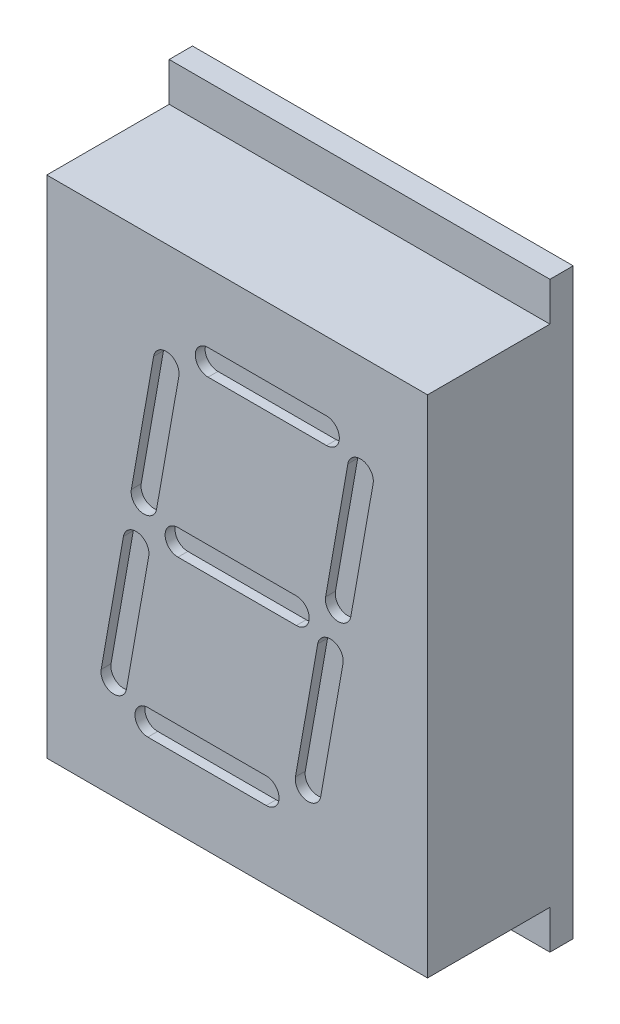
from build123d import *

# Parameters (mm, degrees)
SKETCH2_W           = 9.8
SKETCH2_H           = 15
BOSS_EXTRUDE1_DEPTH = 0.6
SKETCH3_W           = 9.8
SKETCH3_H           = 13
BOSS_EXTRUDE2_DEPTH = 3.15
CUT_EXTRUDE1_DEPTH  = 0.254


with BuildPart() as part:
    # Sketch2 → Boss-Extrude1 (new body)
    with BuildSketch(Plane.XY):
        Rectangle(SKETCH2_W, SKETCH2_H)
    extrude(amount=BOSS_EXTRUDE1_DEPTH)

    # Sketch3 → Boss-Extrude2 (add)
    with BuildSketch(Plane.XY.offset(0.6)):
        Rectangle(SKETCH3_W, SKETCH3_H)
    extrude(amount=BOSS_EXTRUDE2_DEPTH)

    # Sketch8 → Cut-Extrude1 (cut)
    with BuildSketch(Plane.XY.offset(3.75)):
        with BuildLine():
            Line((-2.723886994, 0.579326575), (-2.150500712, 3.831161775))
            ThreePointArc((-2.150500712, 3.831161775), (-1.767978563, 4.099006667), (-1.500133672, 3.716484519))
            Line((-1.500133672, 3.716484519), (-2.073519954, 0.464649318))
            ThreePointArc((-2.073519954, 0.464649318), (-2.456042103, 0.196804426), (-2.723886994, 0.579326575))
        make_face()
        with BuildLine():
            Line((3.499725709, 3.820673425), (2.926339427, 0.568838225))
            ThreePointArc((2.926339427, 0.568838225), (2.543817278, 0.300993333), (2.275972387, 0.683515481))
            Line((2.275972387, 0.683515481), (2.849358669, 3.935350682))
            ThreePointArc((2.849358669, 3.935350682), (3.231880818, 4.203195574), (3.499725709, 3.820673425))
        make_face()
        with BuildLine():
            Line((-3.499725709, -3.820673425), (-2.926339427, -0.568838225))
            ThreePointArc((-2.926339427, -0.568838225), (-2.543817278, -0.300993333), (-2.275972387, -0.683515481))
            Line((-2.275972387, -0.683515481), (-2.849358669, -3.935350682))
            ThreePointArc((-2.849358669, -3.935350682), (-3.231880818, -4.203195574), (-3.499725709, -3.820673425))
        make_face()
        with BuildLine():
            Line((1.500133672, -3.716484519), (2.073519954, -0.464649318))
            ThreePointArc((2.073519954, -0.464649318), (2.456042103, -0.196804426), (2.723886994, -0.579326575))
            Line((2.723886994, -0.579326575), (2.150500712, -3.831161775))
            ThreePointArc((2.150500712, -3.831161775), (1.767978563, -4.099006667), (1.500133672, -3.716484519))
        make_face()
        with BuildLine():
            Line((-2.299838715, -4.0698), (0.748161285, -4.0698))
            ThreePointArc((0.748161285, -4.0698), (1.078361285, -4.4), (0.748161285, -4.7302))
            Line((0.748161285, -4.7302), (-2.299838715, -4.7302))
            ThreePointArc((-2.299838715, -4.7302), (-2.630038715, -4.4), (-2.299838715, -4.0698))
        make_face()
        with BuildLine():
            Line((-1.524, 0.3302), (1.524, 0.3302))
            ThreePointArc((1.524, 0.3302), (1.8542, 0), (1.524, -0.3302))
            Line((1.524, -0.3302), (-1.524, -0.3302))
            ThreePointArc((-1.524, -0.3302), (-1.8542, 0), (-1.524, 0.3302))
        make_face()
        with BuildLine():
            Line((-0.748161285, 4.7302), (2.299838715, 4.7302))
            ThreePointArc((2.299838715, 4.7302), (2.630038715, 4.4), (2.299838715, 4.0698))
            Line((2.299838715, 4.0698), (-0.748161285, 4.0698))
            ThreePointArc((-0.748161285, 4.0698), (-1.078361285, 4.4), (-0.748161285, 4.7302))
        make_face()
    extrude(amount=-CUT_EXTRUDE1_DEPTH, mode=Mode.SUBTRACT)


solid = part.part
